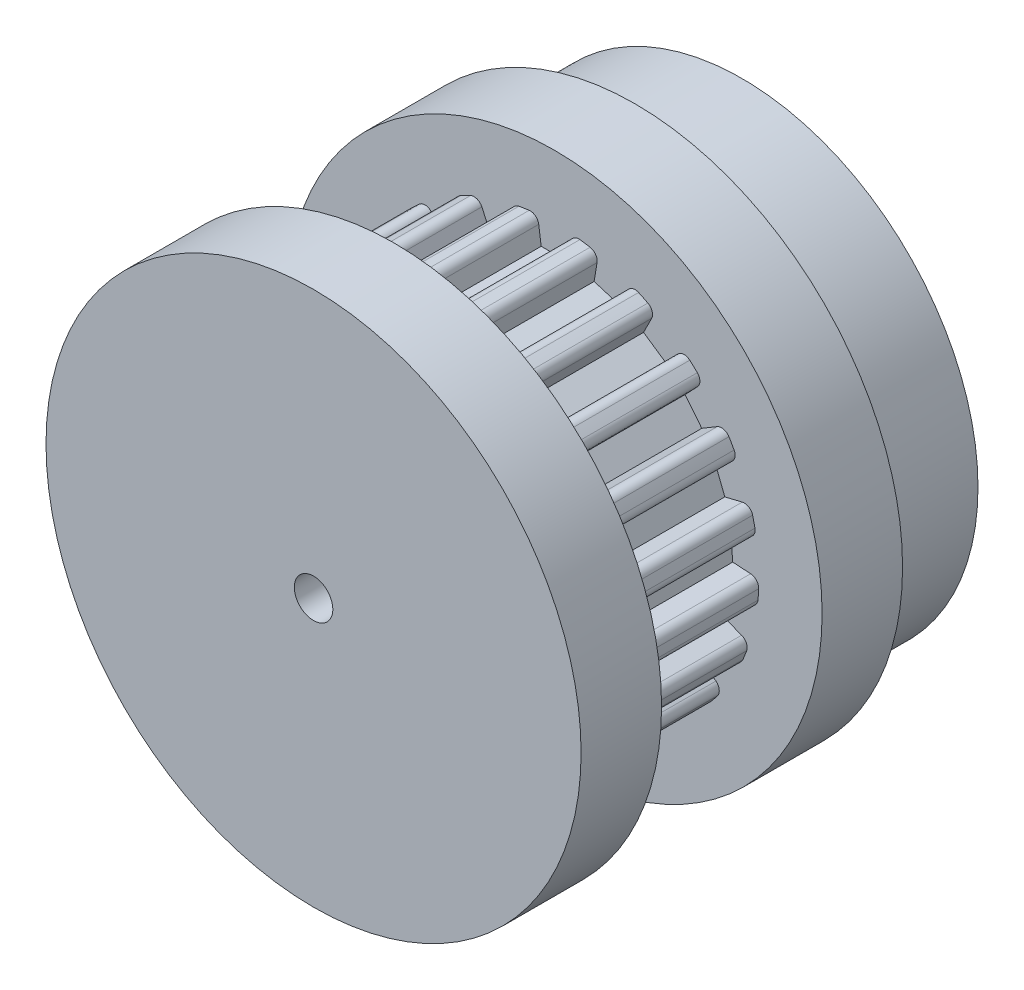
from build123d import *

# Parameters (mm, degrees)
SKETCH3_R                = 12.1285
BOSS_EXTRUDE1_DEPTH      = 9.525
CUT_EXTRUDE1_DEPTH       = 9.525
FILLET1_R                = 0.508
FILLET2_R                = 0.508
SKETCH5_R                = 15.875
BOSS_EXTRUDE2_DEPTH      = 4.7752
CIRPATTERN1_COUNT        = 21
FILLET1_OF_CIRPATTERN1_R = 0.508
FILLET2_OF_CIRPATTERN1_R = 0.508
BOSS_EXTRUDE3_START      = 4.7752
SKETCH7_R                = 15.875
BOSS_EXTRUDE3_DEPTH      = 4.7752
SKETCH8_R                = 14
BOSS_EXTRUDE6_DEPTH      = 6.35
SKETCH14_R               = 1.143
CUT_EXTRUDE5_DEPTH       = 34.918759045
SKETCH15_R               = 1.5
CUT_EXTRUDE6_DEPTH       = 27.618169923


with BuildPart() as part:
    # Sketch3 → Boss-Extrude1 (new body)
    with BuildSketch(Plane.XY):
        with Locations(Location((0, 0, 0), (0, 0, 180))):
            Circle(SKETCH3_R)
    extrude(amount=BOSS_EXTRUDE1_DEPTH)

    # Sketch4 → Cut-Extrude1 (cut)
    with BuildSketch(Plane(origin=(0, 0, 0), x_dir=(-1, 0, 0), z_dir=(0, 0, -1))):
        Polygon((-1.5875, 16.368776586), (1.5875, 16.368776586), (0.79375, 10.541), (-0.79375, 10.541), align=None)
    cut_extrude1 = extrude(amount=-CUT_EXTRUDE1_DEPTH, mode=Mode.SUBTRACT)

    # Fillet1
    fillet1_edges = [part.edges().sort_by_distance(p)[0] for p in [
        (1.004296346, 12.08684827, 4.7625),
    ]]
    fillet(fillet1_edges, radius=FILLET1_R)

    # Fillet2
    fillet2_edges = [part.edges().sort_by_distance(p)[0] for p in [
        (-1.004296346, 12.08684827, 4.7625),
    ]]
    fillet(fillet2_edges, radius=FILLET2_R)

    # Sketch5 → Boss-Extrude2 (add)
    with BuildSketch(Plane.XY.offset(9.525)):
        Circle(SKETCH5_R)
    extrude(amount=BOSS_EXTRUDE2_DEPTH)

    # CirPattern1: Cut-Extrude1 ×21 about axis
    cirpattern1_axis = Axis((0, 0, 0), (0, 0, 1))
    for i in range(1, CIRPATTERN1_COUNT):
        add(cut_extrude1.rotate(cirpattern1_axis, i * 360 / CIRPATTERN1_COUNT), mode=Mode.SUBTRACT)

    # Fillet1 of CirPattern1
    fillet1_of_cirpattern1_edges = [part.edges().sort_by_distance(p)[0] for p in [
        (-2.602982793, 11.845885059, 4.7625),
        (-5.978975487, 10.552362976, 4.7625),
        (-8.823709972, 8.321217134, 4.7625),
        (-10.884419103, 5.350694632, 4.7625),
        (-11.977999831, 1.904739432, 4.7625),
        (-12.007282709, -1.710460226, 4.7625),
        (-10.969665826, -5.173677987, 4.7625),
        (-8.957345995, -8.177191754, 4.7625),
        (-6.149126663, -10.454126149, 4.7625),
        (-2.794530442, -11.802165558, 4.7625),
        (0.808372072, -12.101530764, 4.7625),
        (4.33944718, -11.325621856, 4.7625),
        (7.484943363, -9.543381744, 4.7625),
        (9.965369481, -6.913170283, 4.7625),
        (11.560328788, -3.668693305, 4.7625),
        (12.128102151, -0.098236827, 4.7625),
        (11.618240414, 3.480948424, 4.7625),
        (10.076047031, 6.750836132, 4.7625),
        (7.638552651, 9.420882424, 4.7625),
        (4.522339347, 11.25384197, 4.7625),
    ]]
    fillet(fillet1_of_cirpattern1_edges, radius=FILLET1_OF_CIRPATTERN1_R)

    # Fillet2 of CirPattern1
    fillet2_of_cirpattern1_edges = [part.edges().sort_by_distance(p)[0] for p in [
        (-4.522339347, 11.25384197, 4.7625),
        (-7.638552651, 9.420882424, 4.7625),
        (-10.076047031, 6.750836132, 4.7625),
        (-11.618240414, 3.480948424, 4.7625),
        (-12.128102151, -0.098236827, 4.7625),
        (-11.560328788, -3.668693305, 4.7625),
        (-9.965369481, -6.913170283, 4.7625),
        (-7.484943363, -9.543381744, 4.7625),
        (-4.33944718, -11.325621856, 4.7625),
        (-0.808372072, -12.101530764, 4.7625),
        (2.794530442, -11.802165558, 4.7625),
        (6.149126663, -10.454126149, 4.7625),
        (8.957345995, -8.177191754, 4.7625),
        (10.969665826, -5.173677987, 4.7625),
        (12.007282709, -1.710460226, 4.7625),
        (11.977999831, 1.904739432, 4.7625),
        (10.884419103, 5.350694632, 4.7625),
        (8.823709972, 8.321217134, 4.7625),
        (5.978975487, 10.552362976, 4.7625),
        (2.602982793, 11.845885059, 4.7625),
    ]]
    fillet(fillet2_of_cirpattern1_edges, radius=FILLET2_OF_CIRPATTERN1_R)

    # Sketch7 → Boss-Extrude3 (add)
    with BuildSketch(Plane(origin=(0, 0, 0), x_dir=(-1, 0, 0), z_dir=(0, 0, -1)).offset(BOSS_EXTRUDE3_START)):
        with Locations(Location((0, 0, 0), (0, 0, 180))):
            Circle(SKETCH7_R)
    extrude(amount=-BOSS_EXTRUDE3_DEPTH)

    # Sketch8 → Boss-Extrude6 (add)
    with BuildSketch(Plane(origin=(0, 0, -4.7752), x_dir=(-1, 0, 0), z_dir=(0, 0, -1))):
        Circle(SKETCH8_R)
    extrude(amount=BOSS_EXTRUDE6_DEPTH)

    # Sketch14 → Cut-Extrude5 (cut, through all)
    with BuildSketch(Plane(origin=(0, 0, -11.1252), x_dir=(-1, 0, 0), z_dir=(0, 0, -1))):
        Circle(SKETCH14_R)
    extrude(amount=-CUT_EXTRUDE5_DEPTH, mode=Mode.SUBTRACT)

    # Sketch15 → Cut-Extrude6 (cut, through all)
    with BuildSketch(Plane(origin=(0, 0, 0), x_dir=(1, 0, 0), z_dir=(0, 1, 0))):
        with Locations(Location((0, 7.9502, 0), (0, 0, 270))):
            Circle(SKETCH15_R)
    extrude(amount=-CUT_EXTRUDE6_DEPTH, mode=Mode.SUBTRACT)


solid = part.part
